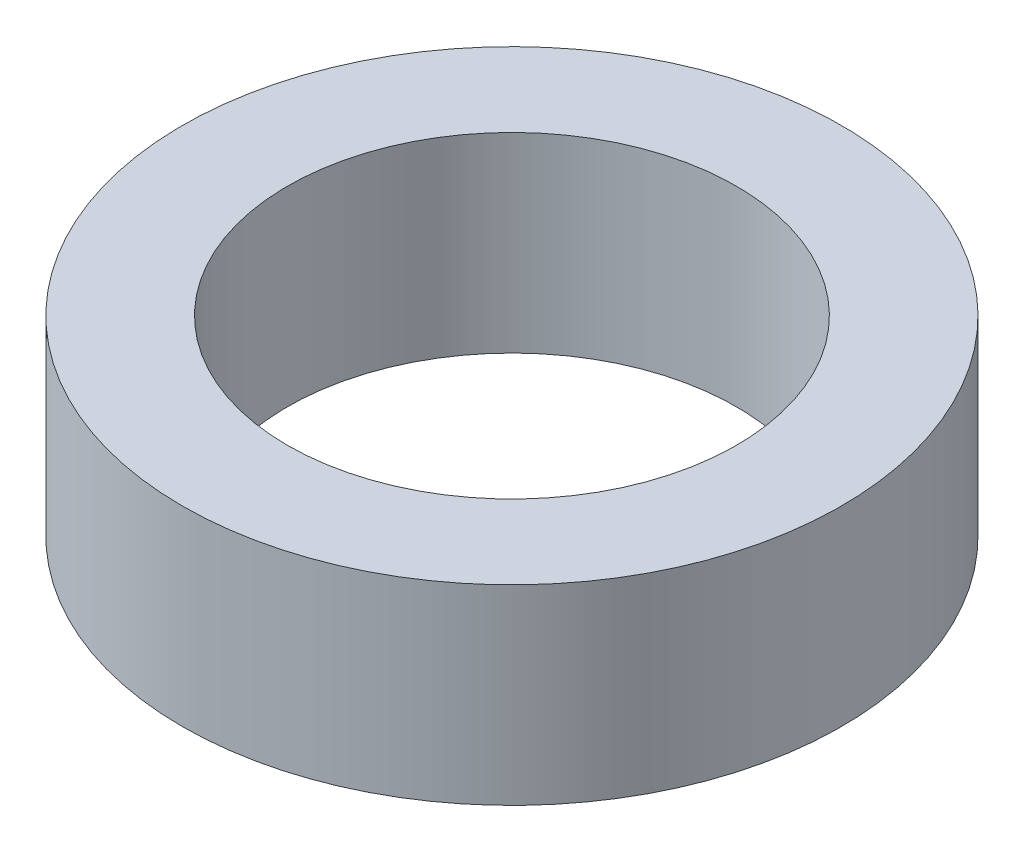
from build123d import *

# Parameters (mm, degrees)
SKETCH1_R           = 1.725
SKETCH1_R_2         = 1.175
BOSS_EXTRUDE1_DEPTH = 1


with BuildPart() as part:
    # Sketch1 → Boss-Extrude1 (new body)
    with BuildSketch(Plane(origin=(0, 0, 0), x_dir=(1, 0, 0), z_dir=(0, 1, 0))):
        with Locations(Location((0, 0, 0), (0, 0, 270))):
            Circle(SKETCH1_R)
        with Locations(Location((0, 0, 0), (0, 0, 270))):
            Circle(SKETCH1_R_2, mode=Mode.SUBTRACT)
    extrude(amount=BOSS_EXTRUDE1_DEPTH)


solid = part.part
